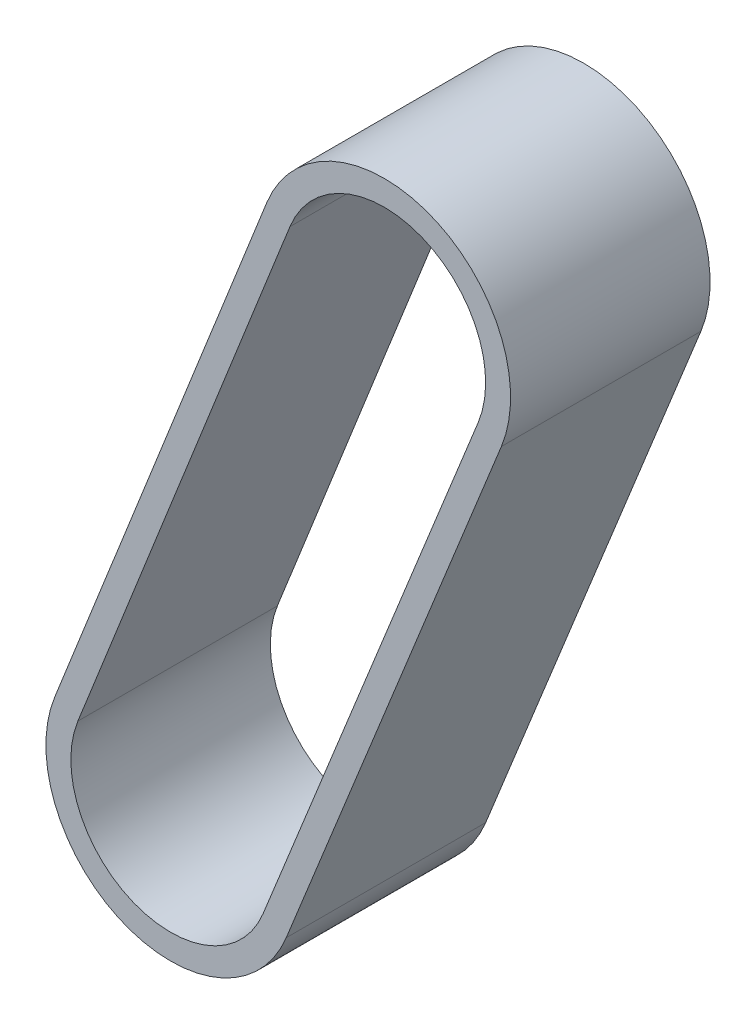
from build123d import *

# Parameters (mm, degrees)
SALIENTE_EXTRUIR1_DEPTH = 6


with BuildPart() as part:
    # Croquis3 → Saliente-Extruir1 (new, symmetric)
    with BuildSketch(Plane.XY.offset(3)):
        with BuildLine():
            Line((-366.794500886, -8.207293434), (-353.852479494, 23.855275987))
            ThreePointArc((-353.852479494, 23.855275987), (-358.075670455, 33.755718434), (-367.963857344, 29.503911452))
            Line((-367.963857344, 29.503911452), (-380.720202712, -2.63298212))
            ThreePointArc((-380.720202712, -2.63298212), (-376.536458173, -12.362880034), (-366.794500886, -8.207293434))
        make_face()
        with BuildLine():
            Line((-366.569674973, 28.950507876), (-379.326020341, -3.186385696))
            ThreePointArc((-379.326020341, -3.186385696), (-375.979024711, -10.970304027), (-368.185458881, -7.645834747))
            Line((-368.185458881, -7.645834747), (-355.243437488, 24.416734674))
            ThreePointArc((-355.243437488, 24.416734674), (-358.633103918, 32.363142427), (-366.569674973, 28.950507876))
        make_face(mode=Mode.SUBTRACT)
    extrude(amount=SALIENTE_EXTRUIR1_DEPTH, both=True)


solid = part.part
